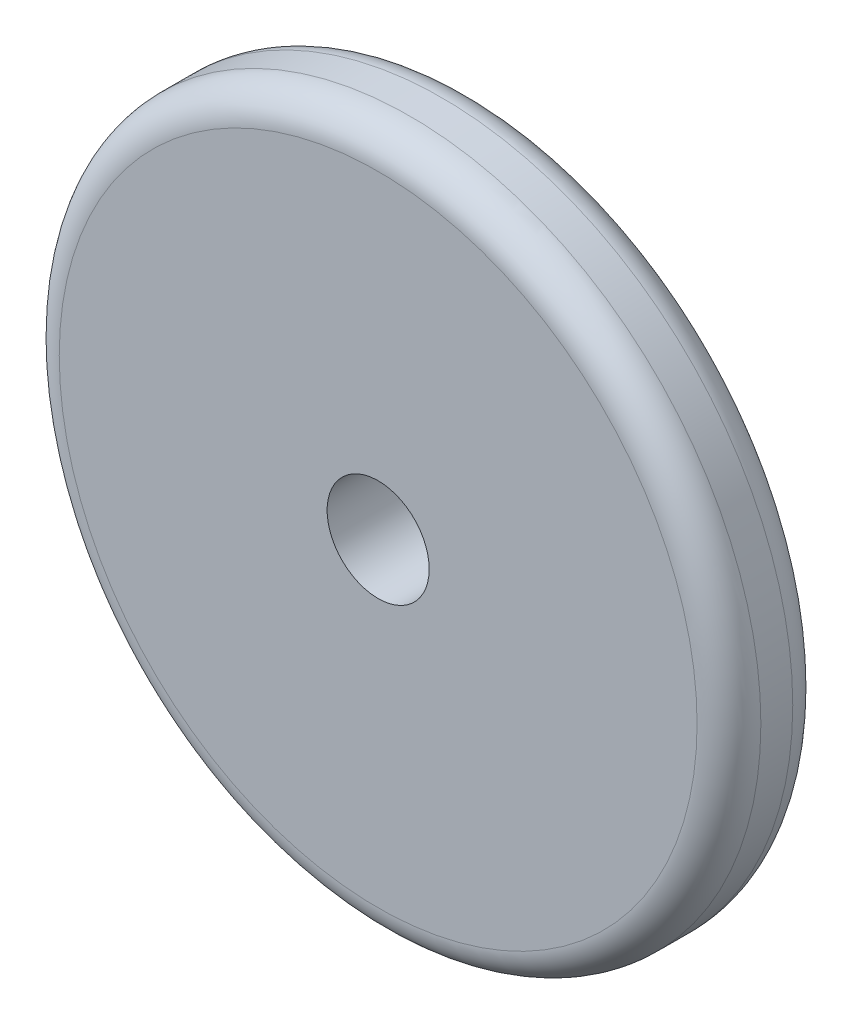
from build123d import *

# Parameters (mm, degrees)
SKETCH1_R           = 11
SKETCH1_R_2         = 1.6
BOSS_EXTRUDE1_DEPTH = 3
FILLET1_R           = 1


with BuildPart() as part:
    # Sketch1 → Boss-Extrude1 (new body)
    with BuildSketch(Plane.XY):
        Circle(SKETCH1_R)
        Circle(SKETCH1_R_2, mode=Mode.SUBTRACT)
    extrude(amount=BOSS_EXTRUDE1_DEPTH)

    # Fillet1
    fillet1_edges = [part.edges().sort_by_distance(p)[0] for p in [
        (-11, 0, 0),
        (-11, 0, 3),
    ]]
    fillet(fillet1_edges, radius=FILLET1_R)


solid = part.part
